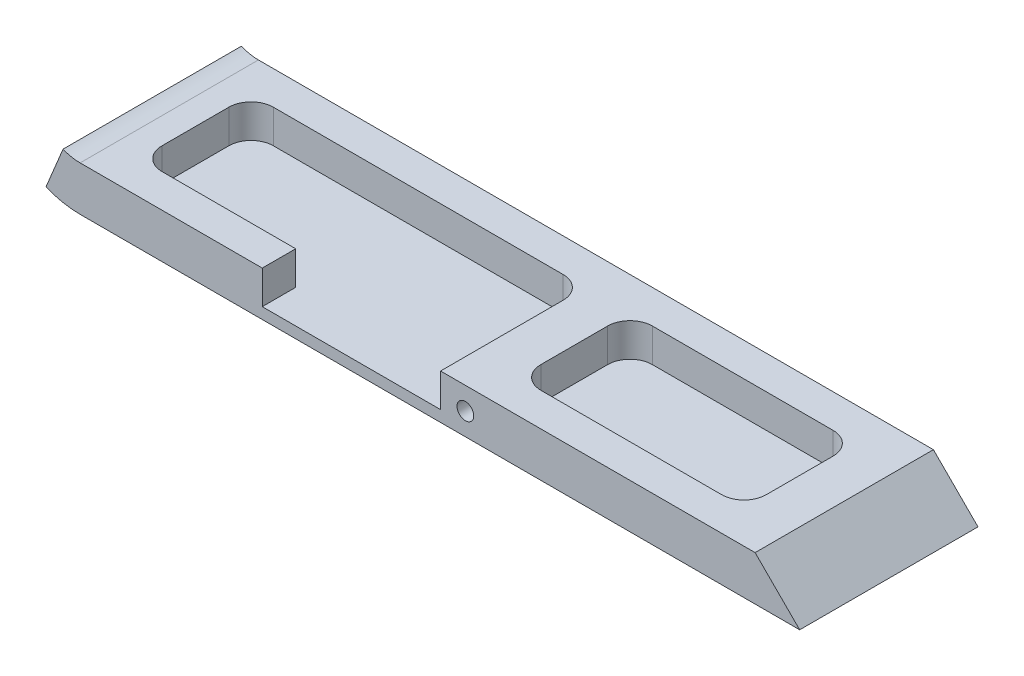
from build123d import *

# Parameters (mm, degrees)
EXTRUDE1_DEPTH     = 50.8
CUT_EXTRUDE1_DEPTH = 9.525
SKETCH3_R          = 2.38125
CUT_EXTRUDE2_DEPTH = 15.875
CUT_EXTRUDE3_START = -15.875
SKETCH4_R          = 2.38125
CUT_EXTRUDE3_DEPTH = 15.875
CUT_EXTRUDE4_DEPTH = 222.795964766
EXTRUDE2_DEPTH     = 50.8


with BuildPart() as part:
    # Sketch1 → Extrude1 (new body)
    with BuildSketch(Plane.XY):
        Polygon((0, 0), (215.526146874, 0), (202.826146874, 12.7), (5.260512242, 12.7), align=None)
    extrude(amount=EXTRUDE1_DEPTH)

    # Sketch2 → Cut-Extrude1 (cut)
    with BuildSketch(Plane(origin=(0, 12.7, 0), x_dir=(-1, 0, 0), z_dir=(0, 1, 0))):
        with BuildLine():
            Line((-113.210512242, 50.8), (-62.410512242, 50.8))
            Line((-62.410512242, 50.8), (-62.410512242, 41.275))
            Line((-62.410512242, 41.275), (-24.310512242, 41.275))
            ThreePointArc((-24.310512242, 41.275), (-19.820384182, 39.415128061), (-17.960512242, 34.925))
            Line((-17.960512242, 34.925), (-17.960512242, 15.875))
            ThreePointArc((-17.960512242, 15.875), (-19.820384182, 11.384871939), (-24.310512242, 9.525))
            Line((-24.310512242, 9.525), (-106.860512242, 9.525))
            ThreePointArc((-106.860512242, 9.525), (-111.350640303, 11.384871939), (-113.210512242, 15.875))
            Line((-113.210512242, 15.875), (-113.210512242, 50.8))
        make_face()
        with BuildLine():
            Line((-132.260512242, 9.525), (-183.776146874, 9.525))
            ThreePointArc((-183.776146874, 9.525), (-188.266274935, 11.384871939), (-190.126146874, 15.875))
            Line((-190.126146874, 15.875), (-190.126146874, 34.925))
            ThreePointArc((-190.126146874, 34.925), (-188.266274935, 39.415128061), (-183.776146874, 41.275))
            Line((-183.776146874, 41.275), (-132.260512242, 41.275))
            ThreePointArc((-132.260512242, 41.275), (-127.770384182, 39.415128061), (-125.910512242, 34.925))
            Line((-125.910512242, 34.925), (-125.910512242, 15.875))
            ThreePointArc((-125.910512242, 15.875), (-127.770384182, 11.384871939), (-132.260512242, 9.525))
        make_face()
    extrude(amount=-CUT_EXTRUDE1_DEPTH, mode=Mode.SUBTRACT)

    # Sketch3 → Cut-Extrude2 (cut)
    with BuildSketch(Plane(origin=(0, 0, 0), x_dir=(-1, 0, 0), z_dir=(0, 0, -1))):
        with Locations((-120.276146874, 6.35)):
            Circle(SKETCH3_R)
    extrude(amount=-CUT_EXTRUDE2_DEPTH, mode=Mode.SUBTRACT)

    # Sketch4 → Cut-Extrude3 (cut)
    with BuildSketch(Plane.XY.offset(50.8).offset(CUT_EXTRUDE3_START)):
        with Locations(Location((120.276146874, 6.35, 0), (0, 0, 180))):
            Circle(SKETCH4_R)
    extrude(amount=CUT_EXTRUDE3_DEPTH, mode=Mode.SUBTRACT)

    # Sketch5 → Cut-Extrude4 (cut, through all)
    with BuildSketch(Plane.XY.offset(50.8)):
        with BuildLine():
            Line((0.800865302, 1.933459874), (0, 0))
            Line((0, 0), (10.521024484, 0))
            ThreePointArc((10.521024484, 0), (5.565730305, 0.488053878), (0.800865302, 1.933459874))
        make_face()
    extrude(amount=-CUT_EXTRUDE4_DEPTH, mode=Mode.SUBTRACT)

    # Sketch6 → Extrude2 (add)
    with BuildSketch(Plane.XY.offset(50.8)):
        with BuildLine():
            Line((5.660944893, 13.666729937), (5.260512242, 12.7))
            Line((5.260512242, 12.7), (10.521024484, 12.7))
            ThreePointArc((10.521024484, 12.7), (8.043377395, 12.944026939), (5.660944893, 13.666729937))
        make_face()
    extrude(amount=-EXTRUDE2_DEPTH)


solid = part.part
